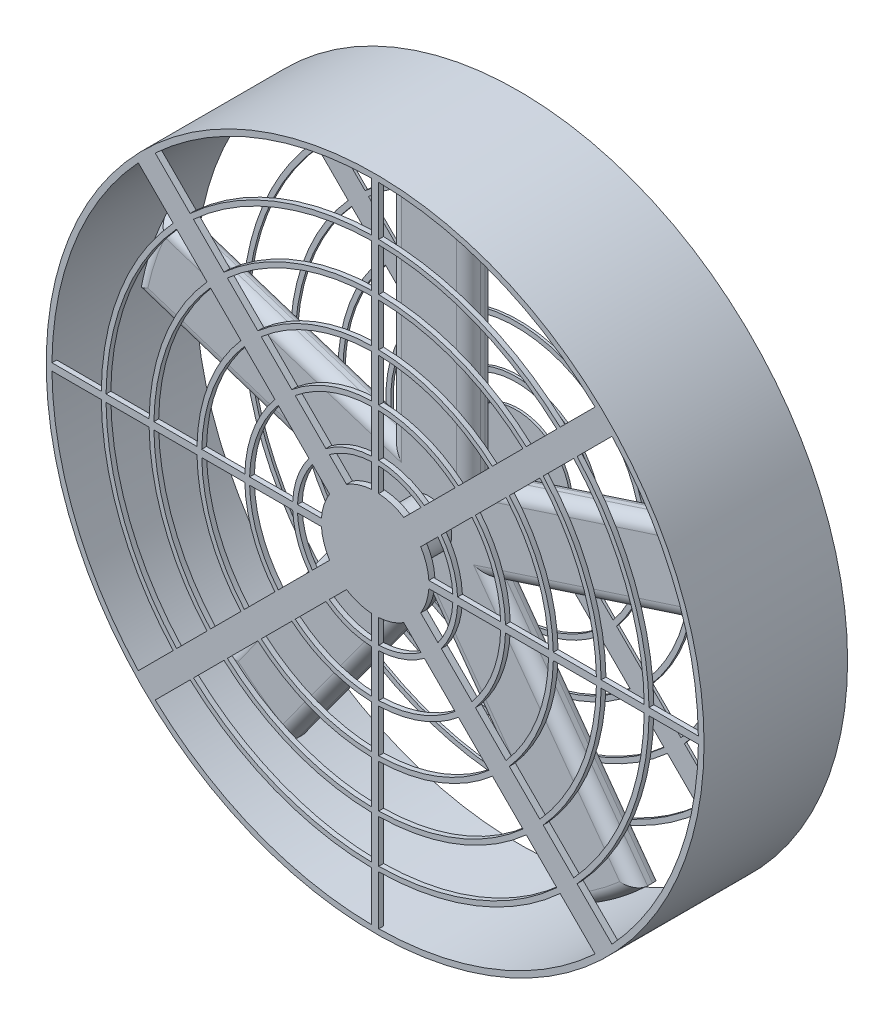
from build123d import *

# Parameters (mm, degrees)
CROQUIS1_R              = 275
CROQUIS1_R_2            = 270.2375
SALIENTE_EXTRUIR1_DEPTH = 120
SALIENTE_EXTRUIR2_DEPTH = 5
CROQUIS3_R              = 45
SALIENTE_EXTRUIR3_DEPTH = 5
CROQUIS5_R              = 19.05
SALIENTE_EXTRUIR4_DEPTH = 40
SALIENTE_EXTRUIR5_DEPTH = 20
MATRIZC1_COUNT          = 5
REDONDEO1_R             = 10
REDONDEO2_R             = 10
SALIENTE_EXTRUIR6_START = -4
SALIENTE_EXTRUIR6_DEPTH = 4
MATRIZC2_COUNT          = 4
SALIENTE_EXTRUIR7_DEPTH = 4
REDONDEO3_R             = 6
CROQUIS9_R              = 270.23749999999995
SALIENTE_EXTRUIR8_DEPTH = 2
CORTAR_EXTRUIR1_START   = -10
CORTAR_EXTRUIR1_DEPTH   = 10


with BuildPart() as part:
    # Croquis1 → Saliente-Extruir1 (new body)
    with BuildSketch(Plane.XY):
        Circle(CROQUIS1_R)
        Circle(CROQUIS1_R_2, mode=Mode.SUBTRACT)
    extrude(amount=SALIENTE_EXTRUIR1_DEPTH)

    # Croquis2 → Saliente-Extruir2 (add)
    with BuildSketch(Plane.XY.offset(120)):
        with BuildLine():
            Line((3.123e-14, 14.14213562373098), (185.24951091022544, 199.3916465339564))
            ThreePointArc((185.24951091022544, 199.3916465339564), (192.45052610995893, 192.4505261099589), (199.3916465339564, 185.24951091022544))
            Line((199.3916465339564, 185.24951091022544), (14.14213562373095, 0))
            Line((14.14213562373095, 0), (199.3916465339564, -185.24951091022544))
            ThreePointArc((199.3916465339564, -185.24951091022544), (192.45052610995893, -192.4505261099589), (185.24951091022544, -199.3916465339564))
            Line((185.24951091022544, -199.3916465339564), (3.123e-14, -14.14213562373098))
            Line((3.123e-14, -14.14213562373098), (-185.24951091022533, -199.39164653395645))
            ThreePointArc((-185.24951091022533, -199.39164653395645), (-192.45052610995876, -192.45052610995896), (-199.39164653395628, -185.2495109102255))
            Line((-199.39164653395628, -185.2495109102255), (-14.142135623730884, -3.46e-15))
            Line((-14.142135623730884, -3.46e-15), (-199.3916465339564, 185.24951091022538))
            ThreePointArc((-199.3916465339564, 185.24951091022538), (-192.45052610995884, 192.45052610995887), (-185.24951091022544, 199.39164653395633))
            Line((-185.24951091022544, 199.39164653395633), (3.123e-14, 14.14213562373098))
        make_face()
    extrude(amount=-SALIENTE_EXTRUIR2_DEPTH)

    # Croquis3 → Saliente-Extruir3 (add)
    with BuildSketch(Plane(origin=(0, 0, 114.99999999999999), x_dir=(-1, 0, 0), z_dir=(0, 0, -1))):
        Circle(CROQUIS3_R)
    extrude(amount=-SALIENTE_EXTRUIR3_DEPTH)

    # Croquis5 → Saliente-Extruir4 (add)
    with BuildSketch(Plane(origin=(0, 0, 114.99999999999999), x_dir=(-1, 0, 0), z_dir=(0, 0, -1))):
        with Locations(Location((0, 0, 0), (0, 0, 180))):
            Circle(CROQUIS5_R)
    extrude(amount=SALIENTE_EXTRUIR4_DEPTH)

    # Croquis6 → Saliente-Extruir5 (add)
    with BuildSketch(Plane(origin=(0, 0, 74.99999999999999), x_dir=(-1, 0, 0), z_dir=(0, 0, -1))):
        with BuildLine():
            ThreePointArc((-19.05, 2.33e-15), (-13.47038418160386, 13.4703841816036), (-3.7107e-13, 19.05))
            Line((0, 19.05), (0, 250.77270509750062))
            ThreePointArc((6.35225e-12, 250.77270509750062), (-16.535989256954046, 250.22691837852284), (-33.000000000000014, 248.59193394379898))
            Line((-33, 248.59193394379895), (-33, -1.587966e-11))
            Line((-33, -1.587966e-11), (-19.05, -1.585473e-11))
        make_face()
        with BuildLine():
            Line((0, 19.05), (0, 0))
            Line((0, 0), (19.05, 0))
            ThreePointArc((19.05, 0), (13.4703841816036, 13.470384181603864), (-3.7107e-13, 19.05))
        make_face()
        with BuildLine():
            Line((-19.05, -1.585473e-11), (-4.163e-14, -1.582068e-11))
            Line((0, 0), (0, 19.05))
            ThreePointArc((-3.7107e-13, 19.05), (-13.47038418160386, 13.4703841816036), (-19.05, 2.33e-15))
        make_face()
        with BuildLine():
            Line((0, 250.77270509750062), (0, 19.05))
            ThreePointArc((-3.7107e-13, 19.05), (13.4703841816036, 13.470384181603864), (19.05, 0))
            Line((19.05, 0), (33, 0))
            Line((33, 0), (33, 248.59193394379895))
            ThreePointArc((33.00000000000001, 248.59193394379898), (16.53598925696038, 250.2269183785224), (6.35225e-12, 250.77270509750062))
        make_face()
    saliente_extruir5 = extrude(amount=SALIENTE_EXTRUIR5_DEPTH)

    # MatrizC1: Saliente-Extruir5 ×5 about axis
    matrizc1_axis = Axis((0, 0, 0), (0, 0, 1))
    for i in range(1, MATRIZC1_COUNT):
        add(saliente_extruir5.rotate(matrizc1_axis, i * 360 / MATRIZC1_COUNT))

    # Redondeo1
    redondeo1_edges = [part.edges().sort_by_distance(p)[0] for p in [
        (-1.599e-14, 250.77270509750065, 74.99999999999999),
        (33, 147.00626865967382, 74.99999999999999),
        (-33, 147.00626865967385, 74.99999999999999),
    ]]
    fillet(redondeo1_edges, radius=REDONDEO1_R)

    # Redondeo2
    redondeo2_edges = [part.edges().sort_by_distance(p)[0] for p in [
        (-124.61370893064556, 75.18770185206401, 74.99999999999999),
        (-238.49901529194085, 77.4930276005047, 74.99999999999999),
        (-150.00883055939212, 14.042570257748391, 74.99999999999999),
        (-113.10567752707475, -99.53365629967374, 74.99999999999999),
        (-147.40049773380042, -202.87938014925504, 74.99999999999999),
        (-59.71055589832824, -138.327482950977, 74.99999999999999),
        (59.71055589832821, -138.327482950977, 74.99999999999999),
        (147.40049773380036, -202.87938014925504, 74.99999999999999),
        (113.10567752707473, -99.53365629967377, 74.99999999999999),
        (150.0088305593921, 14.042570257748345, 74.99999999999999),
        (238.49901529194088, 77.49302760050467, 74.99999999999999),
        (124.61370893064557, 75.18770185206395, 74.99999999999999),
    ]]
    fillet(redondeo2_edges, radius=REDONDEO2_R)

    # Croquis7 → Saliente-Extruir6 (add)
    with BuildSketch(Plane.XY.offset(120).offset(SALIENTE_EXTRUIR6_START)):
        with BuildLine():
            Line((-2.999999999999999, 44.899888641286736), (-2.9999999999999982, 270.22084746786254))
            ThreePointArc((-2.9999999999999982, 270.22084746786254), (1.41e-14, 270.23749999999967), (2.999999999999999, 270.2208474678626))
            Line((2.999999999999999, 270.2208474678626), (2.999999999999999, 44.89988864128678))
            ThreePointArc((2.999999999999999, 44.89988864128678), (-2.59e-15, 44.999999999999446), (-2.999999999999999, 44.899888641286736))
        make_face()
    saliente_extruir6 = extrude(amount=SALIENTE_EXTRUIR6_DEPTH)

    # MatrizC2: Saliente-Extruir6 ×4 about axis
    matrizc2_axis = Axis((0, 0, 0), (0, 0, 1))
    for i in range(1, MATRIZC2_COUNT):
        add(saliente_extruir6.rotate(matrizc2_axis, i * 360 / MATRIZC2_COUNT))

    # Croquis8 → Saliente-Extruir7 (add)
    with BuildSketch(Plane.XY.offset(120)):
        with BuildLine():
            ThreePointArc((-38.34368749959801, 52.48582312332704), (-21.588053762742746, 61.31032486243185), (-2.9999999999996327, 64.93073232299173))
            Line((-3.0000000000000315, 64.93073232299173), (-3.00000000000003, 68.93475175845617))
            ThreePointArc((-3.0000000000019074, 68.93475175845626), (-23.122799412180825, 65.01027724401773), (-41.204184647341165, 55.34632027106965))
            Line((-41.204184647340085, 55.34632027107108), (-38.34368749959717, 52.48582312332817))
        make_face()
        with BuildLine():
            ThreePointArc((-2.9999999999996327, 64.93073232299173), (1.1944e-13, 65), (2.9999999999998566, 64.93073232299172))
            Line((2.999999999999999, 64.93073232299172), (2.999999999999999, 68.93475175845627))
            ThreePointArc((3.0000000000008598, 68.9347517584563), (-5.1669e-13, 69), (-3.0000000000019074, 68.93475175845626))
            Line((-3.00000000000003, 68.93475175845617), (-3.0000000000000315, 64.93073232299173))
        make_face()
        with BuildLine():
            ThreePointArc((2.9999999999998566, 64.93073232299172), (21.588053762742867, 61.310324862431806), (38.34368749959804, 52.485823123327016))
            Line((38.343687499597166, 52.48582312332812), (41.2041846473401, 55.34632027107105))
            ThreePointArc((41.20418464734122, 55.3463202710696), (23.12279941218037, 65.0102772440179), (3.0000000000008598, 68.9347517584563))
            Line((2.999999999999999, 68.93475175845627), (2.999999999999999, 64.93073232299172))
        make_face()
        with BuildLine():
            ThreePointArc((-52.485823123326995, 38.34368749959807), (-45.96194077712556, 45.96194077712561), (-38.34368749959801, 52.48582312332704))
            Line((-38.34368749959717, 52.48582312332817), (-41.204184647340085, 55.34632027107108))
            ThreePointArc((-41.204184647341165, 55.34632027106965), (-48.790367901871726, 48.790367901871825), (-55.34632027106959, 41.20418464734125))
            Line((-55.34632027107105, 41.20418464734013), (-52.485823123328146, 38.34368749959722))
        make_face()
        with BuildLine():
            ThreePointArc((38.34368749959804, 52.485823123327016), (45.96194077712559, 45.961940777125584), (52.485823123327016, 38.34368749959804))
            Line((52.48582312332815, 38.3436874995972), (55.346320271071065, 41.204184647340114))
            ThreePointArc((55.346320271069615, 41.204184647341194), (48.79036790187179, 48.79036790187177), (41.20418464734122, 55.3463202710696))
            Line((41.2041846473401, 55.34632027107105), (38.343687499597166, 52.48582312332812))
        make_face()
        with BuildLine():
            ThreePointArc((52.485823123327016, 38.34368749959804), (61.31032486243132, 21.58805376274424), (64.93073232299157, 3.000000000002762))
            Line((64.9307323229915, 3.0000000000007114), (68.93475175845626, 3.0000000000007523))
            ThreePointArc((68.93475175845629, 3.0000000000013882), (65.01027724401781, 23.122799412180605), (55.346320271069615, 41.204184647341194))
            Line((55.346320271071065, 41.204184647340114), (52.48582312332815, 38.3436874995972))
        make_face()
        with BuildLine():
            ThreePointArc((64.93073232299157, 3.000000000002762), (64.98268077339705, 1.500399780982948), (65, 0))
            ThreePointArc((65, -1.592e-14), (64.98268077339706, -1.5003997809823382), (64.93073232299164, -3.000000000001469))
            Line((64.93073232299153, -2.999999999999319), (68.9347517584563, -2.9999999999992775))
            ThreePointArc((68.93475175845634, -3.000000000000107), (68.98368601101816, -1.500354735806307), (69, -1.69e-14))
            ThreePointArc((69, 0), (68.98368601101815, 1.500354735806909), (68.93475175845629, 3.0000000000013882))
            Line((68.93475175845626, 3.0000000000007523), (64.9307323229915, 3.0000000000007114))
        make_face()
        with BuildLine():
            Line((68.9347517584563, -2.9999999999992775), (64.93073232299153, -2.999999999999319))
            ThreePointArc((64.93073232299164, -3.000000000001469), (61.31032486243152, -21.588053762743677), (52.48582312332699, -38.343687499598076))
            Line((52.48582312332812, -38.343687499597166), (55.34632027107105, -41.2041846473401))
            ThreePointArc((55.34632027106958, -41.20418464734125), (65.01027724401803, -23.122799412180008), (68.93475175845634, -3.000000000000107))
        make_face()
        with BuildLine():
            Line((55.34632027107105, -41.2041846473401), (52.48582312332812, -38.343687499597166))
            ThreePointArc((52.48582312332699, -38.343687499598076), (45.96194077712558, -45.9619407771256), (38.343687499598055, -52.485823123327))
            Line((38.343687499597216, -52.48582312332816), (41.20418464734013, -55.34632027107108))
            ThreePointArc((41.20418464734123, -55.346320271069594), (48.79036790187177, -48.79036790187179), (55.34632027106958, -41.20418464734125))
        make_face()
        with BuildLine():
            Line((41.20418464734013, -55.34632027107108), (38.343687499597216, -52.48582312332816))
            ThreePointArc((38.343687499598055, -52.485823123327), (21.58805376274289, -61.3103248624318), (2.999999999999884, -64.93073232299172))
            Line((3.0000000000000315, -64.93073232299173), (3.00000000000003, -68.93475175845629))
            ThreePointArc((3.0000000000008122, -68.93475175845631), (23.122799412180324, -65.01027724401791), (41.20418464734123, -55.346320271069594))
        make_face()
        with BuildLine():
            Line((3.00000000000003, -68.93475175845629), (3.0000000000000315, -64.93073232299173))
            ThreePointArc((2.999999999999884, -64.93073232299172), (1.0352e-13, -65), (-2.99999999999962, -64.93073232299173))
            Line((-2.999999999999999, -64.93073232299174), (-2.999999999999999, -68.93475175845619))
            ThreePointArc((-3.0000000000018785, -68.93475175845626), (-5.0295e-13, -69), (3.0000000000008122, -68.93475175845631))
        make_face()
        with BuildLine():
            Line((-2.999999999999999, -68.93475175845619), (-2.999999999999999, -64.93073232299174))
            ThreePointArc((-2.99999999999962, -64.93073232299173), (-21.58805376274275, -61.31032486243185), (-38.343687499598026, -52.48582312332702))
            Line((-38.343687499597166, -52.4858231233282), (-41.2041846473401, -55.346320271071136))
            ThreePointArc((-41.20418464734125, -55.34632027106958), (-23.122799412180868, -65.01027724401771), (-3.0000000000018785, -68.93475175845626))
        make_face()
        with BuildLine():
            Line((-41.2041846473401, -55.346320271071136), (-38.343687499597166, -52.4858231233282))
            ThreePointArc((-38.343687499598026, -52.48582312332702), (-45.961940777125555, -45.96194077712562), (-52.48582312332699, -38.34368749959808))
            Line((-52.4858231233281, -38.343687499597245), (-55.346320271071015, -41.204184647340156))
            ThreePointArc((-55.346320271069594, -41.204184647341236), (-48.79036790187179, -48.790367901871775), (-41.20418464734125, -55.34632027106958))
        make_face()
        with BuildLine():
            Line((-55.346320271071015, -41.204184647340156), (-52.4858231233281, -38.343687499597245))
            ThreePointArc((-52.48582312332699, -38.34368749959808), (-61.31032486243176, -21.588053762743), (-64.9307323229917, -3.000000000000061))
            Line((-64.93073232299173, -3.000000000000258), (-68.9347517584564, -3.000000000000271))
            ThreePointArc((-68.93475175845637, -2.999999999999347), (-65.01027724401814, -23.122799412179667), (-55.346320271069594, -41.204184647341236))
        make_face()
        with BuildLine():
            ThreePointArc((-64.9307323229917, -3.000000000000061), (-65, -2.2297e-13), (-64.93073232299173, 2.999999999999616))
            Line((-64.93073232299173, 2.9999999999997726), (-68.93475175845643, 2.999999999999759))
            ThreePointArc((-68.9347517584564, 2.9999999999988742), (-69, -2.3669e-13), (-68.93475175845637, -2.999999999999347))
            Line((-68.9347517584564, -3.000000000000271), (-64.93073232299173, -3.000000000000258))
        make_face()
        with BuildLine():
            ThreePointArc((-64.93073232299173, 2.999999999999616), (-61.31032486243184, 21.58805376274277), (-52.485823123326995, 38.34368749959807))
            Line((-52.485823123328146, 38.34368749959722), (-55.34632027107105, 41.20418464734013))
            ThreePointArc((-55.34632027106959, 41.20418464734125), (-65.01027724401823, 23.12279941217945), (-68.9347517584564, 2.9999999999988742))
            Line((-68.93475175845643, 2.999999999999759), (-64.93073232299173, 2.9999999999997726))
        make_face()
        with BuildLine():
            ThreePointArc((-80.97979530733559, 66.83765968360973), (-74.24621202458748, 74.24621202458749), (-66.83765968360969, 80.97979530733562))
            Line((-66.8376596836074, 80.97979530733838), (-69.67852502093112, 83.8206606446621))
            ThreePointArc((-69.67852502093318, 83.82066064465963), (-77.07463914933368, 77.07463914933369), (-83.8206606446596, 69.67852502093322))
            Line((-83.82066064466207, 69.67852502093112), (-80.97979530733836, 66.83765968360743))
        make_face()
        with BuildLine():
            ThreePointArc((-104.95713410721537, 3.000000000001689), (-98.29520399540338, 36.91954592762533), (-80.97979530733559, 66.83765968360973))
            Line((-80.97979530733836, 66.83765968360743), (-83.82066064466207, 69.67852502093112))
            ThreePointArc((-83.8206606446596, 69.67852502093322), (-101.99253721137411, 38.45155852740523), (-108.95870777500996, 2.999999999998256))
            Line((-108.95870777500998, 2.999999999999619), (-104.95713410721531, 2.999999999999633))
        make_face()
        with BuildLine():
            ThreePointArc((-66.83765968360969, 80.97979530733562), (-36.919545927623524, 98.29520399540405), (-2.9999999999978706, 104.95713410721547))
            Line((-3.00000000000002, 104.95713410721552), (-3.0000000000000187, 108.95870777500994))
            ThreePointArc((-2.9999999999995186, 108.95870777500991), (-38.4515585274058, 101.9925372113739), (-69.67852502093318, 83.82066064465963))
            Line((-69.67852502093112, 83.8206606446621), (-66.8376596836074, 80.97979530733838))
        make_face()
        with BuildLine():
            ThreePointArc((3.0000000000020552, 104.95713410721535), (36.91954592762547, 98.29520399540333), (66.83765968360969, 80.97979530733562))
            Line((66.83765968360738, 80.97979530733834), (69.67852502093115, 83.8206606446621))
            ThreePointArc((69.67852502093324, 83.8206606446596), (38.45155852740584, 101.99253721137389), (2.9999999999995315, 108.95870777500991))
            Line((2.999999999999999, 108.95870777500993), (2.999999999999999, 104.9571341072153))
        make_face()
        with BuildLine():
            ThreePointArc((-2.9999999999978706, 104.95713410721547), (2.10475e-12, 105), (3.0000000000020552, 104.95713410721535))
            Line((2.999999999999999, 104.9571341072153), (2.999999999999999, 108.95870777500993))
            ThreePointArc((2.9999999999995315, 108.95870777500991), (6.67e-15, 109.00000000000001), (-2.9999999999995186, 108.95870777500991))
            Line((-3.0000000000000187, 108.95870777500994), (-3.00000000000002, 104.95713410721552))
        make_face()
        with BuildLine():
            ThreePointArc((66.83765968360969, 80.97979530733562), (74.24621202458748, 74.24621202458749), (80.9797953073356, 66.83765968360969))
            Line((80.97979530733838, 66.83765968360743), (83.8206606446621, 69.67852502093115))
            ThreePointArc((83.82066064465961, 69.6785250209332), (77.0746391493337, 77.07463914933368), (69.67852502093324, 83.8206606446596))
            Line((69.67852502093115, 83.8206606446621), (66.83765968360738, 80.97979530733834))
        make_face()
        with BuildLine():
            ThreePointArc((80.9797953073356, 66.83765968360969), (98.29520399540364, 36.91954592762462), (104.9571341072154, 3.0000000000002185))
            Line((104.95713410721544, 3.000000000001119), (108.95870777500994, 3.00000000000116))
            ThreePointArc((108.9587077750099, 3.0000000000001883), (101.99253721137379, 38.45155852740612), (83.82066064465961, 69.6785250209332))
            Line((83.8206606446621, 69.67852502093115), (80.97979530733838, 66.83765968360743))
        make_face()
        with BuildLine():
            Line((108.95870777500994, 3.00000000000116), (104.95713410721544, 3.000000000001119))
            ThreePointArc((104.9571341072154, 3.0000000000002185), (104.98928297987756, 1.5001531159156332), (105, 0))
            ThreePointArc((105, -2.572e-14), (104.98928297987757, -1.5001531159146626), (104.95713410721545, -2.9999999999983458))
            Line((104.95713410721547, -2.9999999999989), (108.95870777500997, -2.999999999998858))
            ThreePointArc((108.95870777500996, -2.999999999998173), (108.98967645487367, -1.5001420805904724), (109.00000000000001, -2.67e-14))
            ThreePointArc((109.00000000000001, 0), (108.98967645487366, 1.5001420805915155), (108.9587077750099, 3.0000000000001883))
        make_face()
        with BuildLine():
            Line((108.95870777500997, -2.999999999998858), (104.95713410721547, -2.9999999999989))
            ThreePointArc((104.95713410721545, -2.9999999999983458), (98.295203995404, -36.91954592762369), (80.97979530733569, -66.8376596836096))
            Line((80.97979530733834, -66.83765968360738), (83.8206606446621, -69.67852502093115))
            ThreePointArc((83.82066064465958, -69.67852502093324), (101.99253721137414, -38.451558527405155), (108.95870777500996, -2.999999999998173))
        make_face()
        with BuildLine():
            Line((83.8206606446621, -69.67852502093115), (80.97979530733834, -66.83765968360738))
            ThreePointArc((80.97979530733569, -66.8376596836096), (74.24621202458754, -74.24621202458744), (66.83765968360963, -80.97979530733566))
            Line((66.8376596836074, -80.97979530733835), (69.67852502093115, -83.8206606446621))
            ThreePointArc((69.6785250209332, -83.82066064465961), (77.07463914933368, -77.0746391493337), (83.82066064465958, -69.67852502093324))
        make_face()
        with BuildLine():
            Line((69.67852502093115, -83.8206606446621), (66.8376596836074, -80.97979530733835))
            ThreePointArc((66.83765968360963, -80.97979530733566), (36.919545927625386, -98.29520399540336), (3.0000000000020295, -104.95713410721535))
            Line((3.00000000000002, -104.9571341072153), (3.0000000000000187, -108.95870777500994))
            ThreePointArc((2.9999999999995777, -108.95870777500991), (38.45155852740584, -101.99253721137389), (69.6785250209332, -83.82066064465961))
        make_face()
        with BuildLine():
            Line((3.0000000000000187, -108.95870777500994), (3.00000000000002, -104.9571341072153))
            ThreePointArc((3.0000000000020295, -104.95713410721535), (2.12566e-12, -105), (-2.99999999999778, -104.95713410721547))
            Line((-2.999999999999999, -104.95713410721554), (-2.999999999999999, -108.95870777500993))
            ThreePointArc((-2.999999999999521, -108.95870777500991), (-2.002e-14, -109.00000000000001), (2.9999999999995777, -108.95870777500991))
        make_face()
        with BuildLine():
            Line((-2.999999999999999, -108.95870777500993), (-2.999999999999999, -104.95713410721554))
            ThreePointArc((-2.99999999999778, -104.95713410721547), (-36.91954592762333, -98.29520399540412), (-66.83765968360952, -80.97979530733576))
            Line((-66.83765968360733, -80.97979530733839), (-69.67852502093109, -83.82066064466215))
            ThreePointArc((-69.67852502093324, -83.82066064465958), (-38.45155852740587, -101.99253721137387), (-2.999999999999521, -108.95870777500991))
        make_face()
        with BuildLine():
            Line((-69.67852502093109, -83.82066064466215), (-66.83765968360733, -80.97979530733839))
            ThreePointArc((-66.83765968360952, -80.97979530733576), (-74.24621202458736, -74.2462120245876), (-80.97979530733558, -66.83765968360974))
            Line((-80.9797953073383, -66.83765968360746), (-83.82066064466204, -69.6785250209312))
            ThreePointArc((-83.82066064465958, -69.67852502093325), (-77.0746391493337, -77.07463914933368), (-69.67852502093324, -83.82066064465958))
        make_face()
        with BuildLine():
            Line((-83.82066064466204, -69.6785250209312), (-80.9797953073383, -66.83765968360746))
            ThreePointArc((-80.97979530733558, -66.83765968360974), (-98.29520399540326, -36.919545927625656), (-104.95713410721534, -3.000000000002362))
            Line((-104.95713410721527, -3.0000000000003864), (-108.95870777500997, -3.000000000000399))
            ThreePointArc((-108.95870777500994, -2.999999999998907), (-101.99253721137399, -38.45155852740557), (-83.82066064465958, -69.67852502093325))
        make_face()
        with BuildLine():
            ThreePointArc((-104.95713410721534, -3.000000000002362), (-105, -3.6018e-13), (-104.95713410721537, 3.000000000001689))
            Line((-104.95713410721531, 2.999999999999633), (-108.95870777500998, 2.999999999999619))
            ThreePointArc((-108.95870777500996, 2.999999999998256), (-109.00000000000001, -3.2549e-13), (-108.95870777500994, -2.999999999998907))
            Line((-108.95870777500997, -3.000000000000399), (-104.95713410721527, -3.0000000000003864))
        make_face()
        with BuildLine():
            ThreePointArc((-144.96896219536094, -3.000000000000942), (-145, -3.686e-13), (-144.96896219536097, 3.0000000000001403))
            Line((-144.96896219536094, 2.9999999999994933), (-148.96979559628878, 2.9999999999994795))
            ThreePointArc((-148.9697955962887, 2.999999999995728), (-149.00000000000003, -3.7877e-13), (-148.96979559628866, -2.999999999996551))
            Line((-148.96979559628875, -3.000000000000527), (-144.96896219536094, -3.0000000000005143))
        make_face()
        with BuildLine():
            ThreePointArc((-144.96896219536097, 3.0000000000001403), (-135.2641625281457, 52.23606355344351), (-109.35743053926011, 95.21529491552764))
            Line((-109.35743053925931, 95.21529491552833), (-112.19242625057662, 98.05029062684565))
            ThreePointArc((-112.19242625057733, 98.05029062684504), (-138.96066338018124, 53.767406790173204), (-148.9697955962887, 2.999999999995728))
            Line((-148.96979559628878, 2.9999999999994795), (-144.96896219536094, 2.9999999999994933))
        make_face()
        with BuildLine():
            Line((-112.19242625057655, -98.05029062684571), (-109.35743053925921, -95.21529491552835))
            ThreePointArc((-109.35743053926008, -95.21529491552765), (-135.2641625281455, -52.236063553443955), (-144.96896219536094, -3.000000000000942))
            Line((-144.96896219536094, -3.0000000000005143), (-148.96979559628875, -3.000000000000527))
            ThreePointArc((-148.96979559628866, -2.999999999996551), (-138.9606633801811, -53.7674067901736), (-112.19242625057734, -98.05029062684501))
        make_face()
        with BuildLine():
            ThreePointArc((-109.35743053926011, 95.21529491552764), (-102.53048327204938, 102.5304832720494), (-95.21529491552761, 109.35743053926012))
            Line((-95.21529491552833, 109.35743053925927), (-98.05029062684568, 112.19242625057663))
            ThreePointArc((-98.05029062684501, 112.19242625057734), (-105.3589103967956, 105.35891039679561), (-112.19242625057733, 98.05029062684504))
            Line((-112.19242625057662, 98.05029062684565), (-109.35743053925931, 95.21529491552833))
        make_face()
        with BuildLine():
            ThreePointArc((-95.21529491552761, 109.35743053926012), (-52.236063553445526, 135.2641625281449), (-3.0000000000043947, 144.9689621953609))
            Line((-3.000000000000008, 144.9689621953608), (-3.000000000000007, 148.96979559628863))
            ThreePointArc((-2.9999999999994054, 148.9697955962886), (-53.76740679017491, 138.9606633801806), (-98.05029062684501, 112.19242625057734))
            Line((-98.05029062684568, 112.19242625057663), (-95.21529491552833, 109.35743053925927))
        make_face()
        with BuildLine():
            ThreePointArc((-3.0000000000043947, 144.9689621953609), (-2.69562e-12, 145), (2.999999999999037, 144.968962195361))
            Line((2.999999999999999, 144.96896219536103), (2.999999999999999, 148.9697955962885))
            ThreePointArc((3.0000000000024007, 148.96979559628855), (1.49793e-12, 149.00000000000003), (-2.9999999999994054, 148.9697955962886))
            Line((-3.000000000000007, 148.96979559628863), (-3.000000000000008, 144.9689621953608))
        make_face()
        with BuildLine():
            ThreePointArc((2.999999999999037, 144.968962195361), (52.236063553443024, 135.26416252814587), (95.21529491552764, 109.3574305392601))
            Line((95.21529491552832, 109.35743053925927), (98.05029062684565, 112.1924262505766))
            ThreePointArc((98.05029062684507, 112.1924262505773), (53.76740679017634, 138.96066338018002), (3.0000000000024007, 148.96979559628855))
            Line((2.999999999999999, 148.9697955962885), (2.999999999999999, 144.96896219536103))
        make_face()
        with BuildLine():
            ThreePointArc((95.21529491552764, 109.3574305392601), (102.5304832720494, 102.53048327204938), (109.3574305392601, 95.21529491552764))
            Line((109.3574305392593, 95.21529491552835), (112.19242625057664, 98.0502906268457))
            ThreePointArc((112.19242625057731, 98.05029062684505), (105.35891039679561, 105.3589103967956), (98.05029062684507, 112.1924262505773))
            Line((98.05029062684565, 112.1924262505766), (95.21529491552832, 109.35743053925927))
        make_face()
        with BuildLine():
            ThreePointArc((109.3574305392601, 95.21529491552764), (135.2641625281446, 52.23606355344634), (144.96896219536086, 3.000000000006123))
            Line((144.96896219536077, 3.0000000000015263), (148.96979559628852, 3.000000000001567))
            ThreePointArc((148.96979559628855, 3.00000000000276), (138.96066338017997, 53.767406790176494), (112.19242625057731, 98.05029062684505))
            Line((112.19242625057664, 98.0502906268457), (109.3574305392593, 95.21529491552835))
        make_face()
        with BuildLine():
            Line((148.96979559628852, 3.000000000001567), (144.96896219536077, 3.0000000000015263))
            ThreePointArc((144.96896219536086, 3.000000000006123), (144.99224034121158, 1.5000802766313506), (145, 0))
            ThreePointArc((145, -3.551e-14), (144.99224034121158, -1.5000802766301884), (144.96896219536092, -3.0000000000036344))
            Line((144.9689621953608, -2.9999999999984808), (148.96979559628858, -2.9999999999984386))
            ThreePointArc((148.9697955962886, -3.0000000000002447), (148.99244870772313, -1.5000760235739097), (149.00000000000003, -3.649e-14))
            ThreePointArc((149.00000000000003, 0), (148.99244870772313, 1.5000760235751494), (148.96979559628855, 3.00000000000276))
        make_face()
        with BuildLine():
            Line((148.96979559628858, -2.9999999999984386), (144.9689621953608, -2.9999999999984808))
            ThreePointArc((144.96896219536092, -3.0000000000036344), (135.26416252814502, -52.236063553445206), (109.35743053926004, -95.2152949155277))
            Line((109.35743053925925, -95.2152949155283), (112.1924262505766, -98.05029062684565))
            ThreePointArc((112.19242625057723, -98.05029062684515), (138.9606633801804, -53.76740679017538), (148.9697955962886, -3.0000000000002447))
        make_face()
        with BuildLine():
            Line((112.1924262505766, -98.05029062684565), (109.35743053925925, -95.2152949155283))
            ThreePointArc((109.35743053926004, -95.2152949155277), (102.53048327204937, -102.53048327204941), (95.21529491552765, -109.3574305392601))
            Line((95.21529491552837, -109.35743053925933), (98.0502906268457, -112.19242625057663))
            ThreePointArc((98.0502906268451, -112.19242625057726), (105.35891039679558, -105.35891039679562), (112.19242625057723, -98.05029062684515))
        make_face()
        with BuildLine():
            Line((98.0502906268457, -112.19242625057663), (95.21529491552837, -109.35743053925933))
            ThreePointArc((95.21529491552765, -109.3574305392601), (52.23606355344299, -135.26416252814587), (2.999999999998937, -144.968962195361))
            Line((3.000000000000008, -144.96896219536103), (3.000000000000007, -148.96979559628852))
            ThreePointArc((3.0000000000022977, -148.96979559628855), (53.7674067901763, -138.96066338018005), (98.0502906268451, -112.19242625057726))
        make_face()
        with BuildLine():
            Line((3.000000000000007, -148.96979559628852), (3.000000000000008, -144.96896219536103))
            ThreePointArc((2.999999999998937, -144.968962195361), (-2.85993e-12, -145), (-3.000000000004527, -144.9689621953609))
            Line((-2.999999999999999, -144.9689621953608), (-2.999999999999999, -148.96979559628863))
            ThreePointArc((-2.9999999999994422, -148.9697955962886), (1.42835e-12, -149.00000000000003), (3.0000000000022977, -148.96979559628855))
        make_face()
        with BuildLine():
            Line((-2.999999999999999, -148.96979559628863), (-2.999999999999999, -144.9689621953608))
            ThreePointArc((-3.000000000004527, -144.9689621953609), (-52.23606355344556, -135.26416252814488), (-95.2152949155276, -109.35743053926014))
            Line((-95.21529491552826, -109.35743053925934), (-98.0502906268456, -112.19242625057667))
            ThreePointArc((-98.050290626845, -112.19242625057736), (-53.767406790174874, -138.9606633801806), (-2.9999999999994422, -148.9697955962886))
        make_face()
        with BuildLine():
            Line((-98.0502906268456, -112.19242625057667), (-95.21529491552826, -109.35743053925934))
            ThreePointArc((-95.2152949155276, -109.35743053926014), (-102.53048327204937, -102.53048327204941), (-109.35743053926008, -95.21529491552765))
            Line((-109.35743053925921, -95.21529491552835), (-112.19242625057655, -98.05029062684571))
            ThreePointArc((-112.19242625057734, -98.05029062684501), (-105.35891039679562, -105.3589103967956), (-98.050290626845, -112.19242625057736))
        make_face()
        with BuildLine():
            Line((-126.38491744170014, -140.52705306543123), (-123.55243696426604, -137.69457258799713))
            ThreePointArc((-123.55243696426841, -137.6945725879945), (-130.81475451951127, -130.81475451951133), (-137.6945725879944, -123.55243696426848))
            Line((-137.69457258799696, -123.55243696426612), (-140.5270530654311, -126.38491744170025))
            ThreePointArc((-140.52705306543328, -126.3849174416983), (-133.64318164425745, -133.6431816442575), (-126.38491744169825, -140.52705306543334))
        make_face()
        with BuildLine():
            Line((-140.5270530654311, -126.38491744170025), (-137.69457258799696, -123.55243696426612))
            ThreePointArc((-137.6945725879944, -123.55243696426848), (-172.22730484773038, -67.54817143999493), (-184.9756740763498, -3.000000000001872))
            Line((-184.97567407634978, -3.000000000000642), (-188.9761889762836, -3.000000000000655))
            ThreePointArc((-188.97618897628354, -2.999999999996621), (-175.92343815428472, -69.07925816028686), (-140.52705306543328, -126.3849174416983))
        make_face()
        with BuildLine():
            Line((-2.999999999999999, -188.97618897628342), (-2.999999999999999, -184.97567407634995))
            ThreePointArc((-2.999999999997082, -184.9756740763499), (-67.54817143999269, -172.22730484773126), (-123.55243696426841, -137.6945725879945))
            Line((-123.55243696426604, -137.69457258799713), (-126.38491744170014, -140.52705306543123))
            ThreePointArc((-126.38491744169825, -140.52705306543334), (-69.07925816028957, -175.92343815428367), (-3.000000000002469, -188.97618897628342))
        make_face()
        with BuildLine():
            Line((2.999999999999995, -188.97618897628345), (2.9999999999999964, -184.9756740763498))
            ThreePointArc((3.0000000000007923, -184.97567407634983), (1.93777e-12, -185), (-2.999999999997082, -184.9756740763499))
            Line((-2.999999999999999, -184.97567407634995), (-2.999999999999999, -188.97618897628342))
            ThreePointArc((-3.000000000002469, -188.97618897628342), (-1.04191e-12, -189), (3.000000000000218, -188.97618897628345))
        make_face()
        with BuildLine():
            Line((126.38491744170022, -140.52705306543118), (123.55243696426615, -137.6945725879971))
            ThreePointArc((123.55243696426855, -137.69457258799437), (67.54817143999446, -172.22730484773055), (3.0000000000007923, -184.97567407634983))
            Line((2.9999999999999964, -184.9756740763498), (2.999999999999995, -188.97618897628345))
            ThreePointArc((3.000000000000218, -188.97618897628345), (69.07925816028856, -175.92343815428404), (126.3849174416983, -140.52705306543328))
        make_face()
        with BuildLine():
            Line((140.52705306543115, -126.3849174417002), (137.69457258799707, -123.55243696426612))
            ThreePointArc((137.69457258799443, -123.55243696426847), (130.81475451951138, -130.8147545195112), (123.55243696426855, -137.69457258799437))
            Line((123.55243696426615, -137.6945725879971), (126.38491744170022, -140.52705306543118))
            ThreePointArc((126.3849174416983, -140.52705306543328), (133.64318164425757, -133.6431816442574), (140.52705306543334, -126.38491744169825))
        make_face()
        with BuildLine():
            Line((188.9761889762836, -2.9999999999980194), (184.97567407634983, -2.9999999999980616))
            ThreePointArc((184.97567407634986, -2.9999999999989), (172.22730484773095, -67.54817143999345), (137.69457258799443, -123.55243696426847))
            Line((137.69457258799707, -123.55243696426612), (140.52705306543115, -126.3849174417002))
            ThreePointArc((140.52705306543334, -126.38491744169825), (175.92343815428512, -69.07925816028583), (188.97618897628354, -2.999999999994592))
        make_face()
        with BuildLine():
            Line((188.97618897628357, 3.0000000000019744), (184.9756740763498, 3.000000000001934))
            ThreePointArc((184.9756740763498, 3.0000000000019997), (184.9939184191263, 1.5000493117372369), (185, 0))
            ThreePointArc((185, -4.531e-14), (184.99391841912632, -1.5000493117357099), (184.97567407634986, -2.9999999999989))
            Line((184.97567407634983, -2.9999999999980616), (188.9761889762836, -2.9999999999980194))
            ThreePointArc((188.97618897628354, -2.999999999994592), (188.99404715032375, -1.5000472463241163), (189, -4.629e-14))
            ThreePointArc((189, 0), (188.99404715032372, 1.5000472463256305), (188.9761889762835, 2.9999999999976668))
        make_face()
        with BuildLine():
            ThreePointArc((137.6945725879945, 123.55243696426841), (172.22730484773038, 67.54817143999493), (184.9756740763498, 3.0000000000019997))
            Line((184.9756740763498, 3.000000000001934), (188.97618897628357, 3.0000000000019744))
            ThreePointArc((188.9761889762835, 2.9999999999976668), (175.92343815428433, 69.07925816028781), (140.52705306543263, 126.38491744169902))
            Line((140.52705306543123, 126.3849174417003), (137.69457258799707, 123.55243696426614))
        make_face()
        with BuildLine():
            ThreePointArc((123.55243696426845, 137.69457258799446), (130.8147545195113, 130.81475451951127), (137.6945725879945, 123.55243696426841))
            Line((137.69457258799707, 123.55243696426614), (140.52705306543123, 126.3849174417003))
            ThreePointArc((140.52705306543263, 126.38491744169902), (133.64318164425714, 133.64318164425782), (126.38491744169826, 140.52705306543334))
            Line((126.38491744170022, 140.52705306543118), (123.5524369642661, 137.69457258799704))
        make_face()
        with BuildLine():
            ThreePointArc((3.0000000000010023, 184.9756740763498), (67.54817143999449, 172.22730484773055), (123.55243696426845, 137.69457258799446))
            Line((123.5524369642661, 137.69457258799704), (126.38491744170022, 140.52705306543118))
            ThreePointArc((126.38491744169826, 140.52705306543334), (69.07925816028857, 175.92343815428404), (3.0000000000002642, 188.97618897628345))
            Line((2.999999999999999, 188.97618897628348), (2.999999999999999, 184.97567407634983))
        make_face()
        with BuildLine():
            ThreePointArc((-2.999999999996995, 184.9756740763499), (1.98308e-12, 185), (3.000000000000961, 184.97567407634983))
            Line((2.999999999999999, 184.97567407634983), (2.999999999999999, 188.97618897628348))
            ThreePointArc((3.0000000000002642, 188.97618897628345), (-1.16349e-12, 189), (-3.0000000000025486, 188.97618897628342))
            Line((-2.999999999999995, 188.97618897628337), (-2.9999999999999964, 184.97567407634992))
        make_face()
        with BuildLine():
            ThreePointArc((-123.55243696426842, 137.69457258799446), (-67.54817143999264, 172.2273048477313), (-2.999999999996995, 184.9756740763499))
            Line((-2.9999999999999964, 184.97567407634992), (-2.999999999999995, 188.97618897628337))
            ThreePointArc((-3.0000000000025486, 188.97618897628342), (-69.07925816028968, 175.92343815428362), (-126.38491744169833, 140.52705306543325))
            Line((-126.38491744170025, 140.52705306543118), (-123.55243696426611, 137.69457258799702))
        make_face()
        with BuildLine():
            ThreePointArc((-137.6945725879945, 123.55243696426841), (-130.81475451951127, 130.8147545195113), (-123.55243696426842, 137.69457258799446))
            Line((-123.55243696426611, 137.69457258799702), (-126.38491744170025, 140.52705306543118))
            ThreePointArc((-126.38491744169833, 140.52705306543325), (-133.64318164425754, 133.64318164425742), (-140.52705306543334, 126.38491744169822))
            Line((-140.52705306543118, 126.3849174417002), (-137.69457258799707, 123.5524369642661))
        make_face()
        with BuildLine():
            ThreePointArc((-184.97567407634983, 3.0000000000008495), (-172.2273048477306, 67.54817143999435), (-137.6945725879945, 123.55243696426841))
            Line((-137.69457258799707, 123.5524369642661), (-140.52705306543118, 126.3849174417002))
            ThreePointArc((-140.52705306543334, 126.38491744169822), (-175.92343815428492, 69.07925816028636), (-188.97618897628354, 2.9999999999955764))
            Line((-188.9761889762836, 2.9999999999993396), (-184.97567407634978, 2.9999999999993534))
        make_face()
        with BuildLine():
            ThreePointArc((-184.9756740763498, -3.000000000001872), (-185, -4.7028e-13), (-184.97567407634983, 3.0000000000008495))
            Line((-184.97567407634978, 2.9999999999993534), (-188.9761889762836, 2.9999999999993396))
            ThreePointArc((-188.97618897628354, 2.9999999999955764), (-189, -4.8045e-13), (-188.97618897628354, -2.999999999996621))
            Line((-188.9761889762836, -3.000000000000655), (-184.97567407634978, -3.000000000000642))
        make_face()
        with BuildLine():
            ThreePointArc((-224.97999911103219, -2.999999999991857), (-225, -5.7197e-13), (-224.9799991110322, 2.999999999990713))
            Line((-224.97999911103233, 2.999999999999214), (-228.98034850178726, 2.9999999999991998))
            ThreePointArc((-228.98034850178732, 3.000000000004591), (-229, -5.8213e-13), (-228.98034850178732, -3.000000000005755))
            Line((-228.98034850178723, -3.000000000000783), (-224.97999911103233, -3.00000000000077))
        make_face()
        with BuildLine():
            ThreePointArc((-224.9799991110322, 2.999999999990713), (-209.1876736306015, 82.85841659733155), (-166.0128810643913, 151.8707454406551))
            Line((-166.01288106438858, 151.87074544065757), (-168.84405690460645, 154.70192128087544))
            ThreePointArc((-168.84405690460332, 154.70192128087834), (-212.88361283648433, 84.38937957874697), (-228.98034850178732, 3.000000000004591))
            Line((-228.98034850178726, 2.9999999999991998), (-224.97999911103233, 2.999999999999214))
        make_face()
        with BuildLine():
            Line((-168.84405690460636, -154.70192128087555), (-166.01288106438844, -151.87074544065763))
            ThreePointArc((-166.01288106439128, -151.87074544065513), (-209.1876736306013, -82.85841659733207), (-224.97999911103219, -2.999999999991857))
            Line((-224.97999911103233, -3.00000000000077), (-228.98034850178723, -3.000000000000783))
            ThreePointArc((-228.98034850178732, -3.000000000005755), (-212.88361283648408, -84.38937957874766), (-168.84405690460312, -154.7019212808785))
        make_face()
        with BuildLine():
            Line((-154.70192128087538, -168.8440569046065), (-151.87074544065757, -166.01288106438867))
            ThreePointArc((-151.87074544065504, -166.0128810643914), (-159.09902576697314, -159.09902576697323), (-166.01288106439128, -151.87074544065513))
            Line((-166.01288106438844, -151.87074544065763), (-168.84405690460636, -154.70192128087555))
            ThreePointArc((-168.84405690460312, -154.7019212808785), (-161.92745289171935, -161.9274528917194), (-154.70192128087845, -168.84405690460324))
        make_face()
        with BuildLine():
            Line((-2.999999999999999, -228.9803485017871), (-2.999999999999999, -224.97999911103204))
            ThreePointArc((-3.000000000002117, -224.97999911103207), (-82.85841659733677, -209.18767363059942), (-151.87074544065504, -166.0128810643914))
            Line((-151.87074544065757, -166.01288106438867), (-154.70192128087538, -168.8440569046065))
            ThreePointArc((-154.70192128087845, -168.84405690460324), (-84.38937957874953, -212.88361283648334), (-3.0000000000101976, -228.98034850178723))
        make_face()
        with BuildLine():
            Line((2.9999999999999836, -228.98034850178723), (2.999999999999985, -224.97999911103207))
            ThreePointArc((3.0000000000002354, -224.9799991110321), (-8.4069e-13, -225), (-3.000000000002117, -224.97999911103207))
            Line((-2.999999999999999, -224.97999911103204), (-2.999999999999999, -228.9803485017871))
            ThreePointArc((-3.0000000000101976, -228.98034850178723), (-2.27939e-12, -229), (3.000000000005639, -228.98034850178732))
        make_face()
        with BuildLine():
            Line((154.70192128087555, -168.8440569046065), (151.87074544065766, -166.0128810643886))
            ThreePointArc((151.87074544065533, -166.01288106439108), (82.85841659733613, -209.1876736305997), (3.0000000000002354, -224.9799991110321))
            Line((2.999999999999985, -224.97999911103207), (2.9999999999999836, -228.98034850178723))
            ThreePointArc((3.000000000005639, -228.98034850178732), (84.38937957874757, -212.8836128364841), (154.7019212808785, -168.84405690460315))
        make_face()
        with BuildLine():
            Line((168.84405690460648, -154.70192128087552), (166.01288106438858, -151.87074544065763))
            ThreePointArc((166.01288106439128, -151.8707454406551), (159.0990257669733, -159.09902576697309), (151.87074544065533, -166.01288106439108))
            Line((151.87074544065766, -166.0128810643886), (154.70192128087555, -168.8440569046065))
            ThreePointArc((154.7019212808785, -168.84405690460315), (161.92745289171935, -161.9274528917194), (168.8440569046031, -154.7019212808786))
        make_face()
        with BuildLine():
            Line((228.98034850178732, -2.9999999999976), (224.97999911103196, -2.9999999999976423))
            ThreePointArc((224.97999911103204, -3.0000000000039293), (209.18767363059908, -82.85841659733771), (166.01288106439128, -151.8707454406551))
            Line((166.01288106438858, -151.87074544065763), (168.84405690460648, -154.70192128087552))
            ThreePointArc((168.8440569046031, -154.7019212808786), (212.8836128364849, -84.38937957874558), (228.98034850178735, -3.000000000001263))
        make_face()
        with BuildLine():
            ThreePointArc((166.01288106439128, 151.87074544065513), (209.18767363059837, 82.85841659733946), (224.979999111032, 3.000000000007684))
            Line((224.97999911103193, 3.0000000000023412), (228.9803485017873, 3.0000000000023817))
            ThreePointArc((228.98034850178732, 3.0000000000052593), (212.88361283648422, 84.38937957874734), (168.84405690460324, 154.70192128087842))
            Line((168.84405690460645, 154.7019212808755), (166.0128810643886, 151.87074544065766))
        make_face()
        with BuildLine():
            ThreePointArc((151.87074544065507, 166.01288106439134), (159.09902576697314, 159.09902576697323), (166.01288106439128, 151.87074544065513))
            Line((166.0128810643886, 151.87074544065766), (168.84405690460645, 154.7019212808755))
            ThreePointArc((168.84405690460324, 154.70192128087842), (161.92745289171938, 161.92745289171935), (154.70192128087842, 168.84405690460326))
            Line((154.70192128087547, 168.84405690460642), (151.87074544065763, 166.01288106438858))
        make_face()
        with BuildLine():
            ThreePointArc((3.000000000000541, 224.9799991110321), (82.85841659733609, 209.1876736305997), (151.87074544065507, 166.01288106439134))
            Line((151.87074544065763, 166.01288106438858), (154.70192128087547, 168.84405690460642))
            ThreePointArc((154.70192128087842, 168.84405690460326), (84.38937957874752, 212.88361283648413), (3.000000000005746, 228.98034850178732))
            Line((2.999999999999999, 228.98034850178726), (2.999999999999999, 224.9799991110321))
        make_face()
        with BuildLine():
            ThreePointArc((-3.000000000002062, 224.97999911103207), (-7.8558e-13, 225), (3.000000000000541, 224.9799991110321))
            Line((2.999999999999999, 224.9799991110321), (2.999999999999999, 228.98034850178726))
            ThreePointArc((3.000000000005746, 228.98034850178732), (-2.1216e-12, 229), (-3.0000000000099893, 228.98034850178726))
            Line((-2.9999999999999836, 228.9803485017871), (-2.999999999999985, 224.97999911103204))
        make_face()
        with BuildLine():
            ThreePointArc((-151.87074544065513, 166.01288106439128), (-82.85841659733686, 209.1876736305994), (-3.000000000002062, 224.97999911103207))
            Line((-2.999999999999985, 224.97999911103204), (-2.9999999999999836, 228.9803485017871))
            ThreePointArc((-3.0000000000099893, 228.98034850178726), (-84.38937957874948, 212.88361283648337), (-154.7019212808784, 168.84405690460326))
            Line((-154.7019212808755, 168.8440569046064), (-151.87074544065766, 166.01288106438855))
        make_face()
        with BuildLine():
            ThreePointArc((-166.0128810643913, 151.8707454406551), (-159.09902576697317, 159.0990257669732), (-151.87074544065513, 166.01288106439128))
            Line((-151.87074544065766, 166.01288106438855), (-154.7019212808755, 168.8440569046064))
            ThreePointArc((-154.7019212808784, 168.84405690460326), (-161.92745289171935, 161.92745289171938), (-168.84405690460332, 154.70192128087834))
            Line((-168.84405690460645, 154.70192128087544), (-166.01288106438858, 151.87074544065757))
        make_face()
    extrude(amount=-SALIENTE_EXTRUIR7_DEPTH)

    # Redondeo3
    redondeo3_edges = [part.edges().sort_by_distance(p)[0] for p in [
        (-33, 147.00626865967385, 54.999999999999986),
        (33, 147.00626865967382, 54.999999999999986),
        (129.61370893064557, 76.81230033322848, 54.999999999999986),
        (113.10567752707473, -99.53365629967377, 54.999999999999986),
        (-59.71055589832824, -138.327482950977, 54.999999999999986),
        (-150.00883055939212, 14.042570257748391, 54.999999999999986),
        (-129.61370893064552, 76.8123003332285, 54.999999999999986),
        (-113.10567752707475, -99.53365629967374, 54.999999999999986),
        (59.71055589832821, -138.327482950977, 54.999999999999986),
        (150.0088305593921, 14.042570257748345, 54.999999999999986),
    ]]
    fillet(redondeo3_edges, radius=REDONDEO3_R)


with BuildPart() as body_2:
    # Croquis9 → Saliente-Extruir8 (new body)
    with BuildSketch(Plane(origin=(0, 0, 0), x_dir=(-1, 0, 0), z_dir=(0, 0, -1))):
        Circle(CROQUIS9_R)
    extrude(amount=-SALIENTE_EXTRUIR8_DEPTH)

    # Croquis10 → Cortar-Extruir1 (cut)
    with BuildSketch(Plane(origin=(0, 0, 0), x_dir=(-1, 0, 0), z_dir=(0, 0, -1)).offset(CORTAR_EXTRUIR1_START)):
        with BuildLine():
            Line((-168.84405690460613, 154.70192128087518), (-198.02696115670307, 183.88482553297212))
            ThreePointArc((-198.02696115670312, 183.88482553297214), (-270.23749999999995, 0), (-198.0269611567031, -183.88482553297212))
            Line((-198.02696115670307, -183.88482553297212), (-168.84405690460613, -154.70192128087518))
            ThreePointArc((-168.8440569046062, -154.70192128087518), (-228.99999999999994, 1.421e-14), (-168.84405690460613, 154.7019212808752))
        make_face()
        with BuildLine():
            Line((-166.01288106438884, 151.87074544065788), (-140.52705306543137, 126.38491744170044))
            ThreePointArc((-140.52705306543137, 126.38491744170044), (-189, 2.315e-14), (-140.52705306543137, -126.38491744170044))
            Line((-140.52705306543137, -126.38491744170044), (-166.01288106438884, -151.87074544065788))
            ThreePointArc((-166.01288106438884, -151.87074544065788), (-225.00000000000006, 2.755e-14), (-166.01288106438884, 151.87074544065788))
        make_face()
        with BuildLine():
            Line((-137.6945725879968, 123.55243696426582), (-112.19242625057669, 98.05029062684572))
            ThreePointArc((-112.19242625057669, 98.05029062684572), (-149, 1.825e-14), (-112.19242625057669, -98.05029062684572))
            Line((-112.19242625057669, -98.05029062684572), (-137.6945725879968, -123.55243696426582))
            ThreePointArc((-137.6945725879968, -123.55243696426582), (-185, 2.266e-14), (-137.6945725879968, 123.55243696426582))
        make_face()
        with BuildLine():
            Line((-109.3574305392594, 95.21529491552843), (-83.82066064466167, 69.67852502093072))
            ThreePointArc((-83.82066064466167, 69.67852502093072), (-109.00000000000001, 1.335e-14), (-83.82066064466167, -69.67852502093072))
            Line((-83.82066064466167, -69.67852502093072), (-109.3574305392594, -95.21529491552843))
            ThreePointArc((-109.3574305392594, -95.21529491552843), (-145, 1.776e-14), (-109.3574305392594, 95.21529491552843))
        make_face()
        with BuildLine():
            Line((-80.9797953073379, 66.83765968360693), (-55.34632027107068, 41.20418464733973))
            ThreePointArc((-55.34632027107068, 41.20418464733973), (-68.99999999999997, 8.45e-15), (-55.34632027107068, -41.20418464733974))
            Line((-55.34632027107068, -41.20418464733974), (-80.9797953073379, -66.83765968360694))
            ThreePointArc((-80.9797953073379, -66.83765968360694), (-105, 1.286e-14), (-80.9797953073379, 66.83765968360693))
        make_face()
        with BuildLine():
            ThreePointArc((-38.095251926842614, 23.953116303111663), (-45, 5.51e-15), (-38.095251926842614, -23.953116303111663))
            Line((-38.095251926842614, -23.953116303111663), (-52.48582312332786, -38.34368749959691))
            ThreePointArc((-52.48582312332786, -38.34368749959691), (-65, 7.96e-15), (-52.485823123327854, 38.343687499596896))
            Line((-52.485823123327854, 38.343687499596896), (-38.095251926842614, 23.953116303111663))
        make_face()
        with BuildLine():
            ThreePointArc((-23.953116303111667, -38.095251926842614), (-1.723e-14, -45), (23.953116303111624, -38.09525192684265))
            Line((23.953116303111624, -38.09525192684265), (38.34368749959687, -52.4858231233279))
            ThreePointArc((38.34368749959687, -52.4858231233279), (-2.489e-14, -65), (-38.3436874995969, -52.485823123327854))
            Line((-38.3436874995969, -52.485823123327854), (-23.953116303111667, -38.095251926842614))
        make_face()
        with BuildLine():
            ThreePointArc((-41.20418464733974, -55.34632027107068), (-2.642e-14, -68.99999999999999), (41.20418464733969, -55.34632027107072))
            Line((41.20418464733969, -55.34632027107072), (66.83765968360689, -80.97979530733794))
            ThreePointArc((66.83765968360689, -80.97979530733794), (-4.02e-14, -105.00000000000001), (-66.83765968360694, -80.9797953073379))
            Line((-66.83765968360694, -80.9797953073379), (-41.20418464733974, -55.34632027107068))
        make_face()
        with BuildLine():
            ThreePointArc((-69.67852502093072, -83.82066064466167), (-4.173e-14, -109.00000000000001), (69.67852502093068, -83.82066064466173))
            Line((69.67852502093068, -83.82066064466173), (95.21529491552839, -109.35743053925948))
            ThreePointArc((95.21529491552839, -109.35743053925948), (-5.551e-14, -145), (-95.21529491552843, -109.3574305392594))
            Line((-95.21529491552843, -109.3574305392594), (-69.67852502093072, -83.82066064466167))
        make_face()
        with BuildLine():
            ThreePointArc((-98.05029062684572, -112.19242625057669), (-5.705e-14, -149), (98.05029062684568, -112.19242625057676))
            Line((98.05029062684568, -112.19242625057676), (123.55243696426577, -137.69457258799687))
            ThreePointArc((123.55243696426577, -137.69457258799687), (-2.975e-14, -185), (-123.55243696426582, -137.6945725879968))
            Line((-123.55243696426582, -137.6945725879968), (-98.05029062684572, -112.19242625057669))
        make_face()
        with BuildLine():
            ThreePointArc((-151.8707454406579, -166.01288106438886), (-7.105e-14, -225.0000000000001), (151.87074544065786, -166.01288106438892))
            Line((151.87074544065783, -166.01288106438895), (126.38491744170035, -140.52705306543146))
            ThreePointArc((126.38491744170037, -140.5270530654315), (-6.395e-14, -189.00000000000003), (-126.38491744170045, -140.5270530654314))
            Line((-126.38491744170044, -140.52705306543137), (-151.87074544065788, -166.01288106438884))
        make_face()
        with BuildLine():
            Line((-154.70192128087518, -168.84405690460613), (-183.88482553297212, -198.02696115670307))
            ThreePointArc((-183.88482553297214, -198.02696115670307), (-1.1369e-13, -270.2375), (183.884825532972, -198.02696115670324))
            Line((183.88482553297203, -198.02696115670315), (154.70192128087513, -168.84405690460625))
            ThreePointArc((154.70192128087515, -168.84405690460622), (-7.816e-14, -228.99999999999994), (-154.70192128087518, -168.84405690460613))
        make_face()
        with BuildLine():
            ThreePointArc((270.23749999999995, 1.421e-14), (251.5378871281964, 98.77751639585149), (198.02696115670315, 183.88482553297206))
            Line((198.02696115670312, 183.8848255329721), (168.84405690460616, 154.70192128087518))
            ThreePointArc((168.8440569046062, 154.70192128087518), (228.99999999999994, -7.816e-14), (168.84405690460608, -154.70192128087527))
            Line((168.84405690460608, -154.70192128087524), (198.026961156703, -183.8848255329722))
            ThreePointArc((198.02696115670298, -183.88482553297217), (251.53788712819633, -98.77751639585159), (270.23749999999995, 1.421e-14))
        make_face()
        with BuildLine():
            Line((140.52705306543137, -126.3849174417005), (166.01288106438875, -151.8707454406579))
            ThreePointArc((166.01288106438878, -151.8707454406579), (225.00000000000003, -3.553e-14), (166.0128810643889, 151.87074544065788))
            Line((166.01288106438886, 151.87074544065788), (140.5270530654314, 126.38491744170044))
            ThreePointArc((140.52705306543146, 126.38491744170048), (189.00000000000006, -3.553e-14), (140.5270530654314, -126.38491744170054))
        make_face()
        with BuildLine():
            Line((137.69457258799676, -123.55243696426592), (112.19242625057666, -98.0502906268458))
            ThreePointArc((112.19242625057666, -98.0502906268458), (149.00000000000003, -3.308e-14), (112.1924262505767, 98.05029062684577))
            Line((112.1924262505767, 98.05029062684577), (137.6945725879968, 123.55243696426582))
            ThreePointArc((137.6945725879968, 123.55243696426582), (185.00000000000003, -4.108e-14), (137.69457258799676, -123.55243696426592))
        make_face()
        with BuildLine():
            Line((109.35743053925937, -95.2152949155285), (83.82066064466164, -69.67852502093079))
            ThreePointArc((83.82066064466164, -69.67852502093079), (109.00000000000003, -1.21e-14), (83.82066064466166, 69.67852502093078))
            Line((83.82066064466166, 69.67852502093078), (109.3574305392594, 95.21529491552846))
            ThreePointArc((109.3574305392594, 95.21529491552846), (145.00000000000003, -3.22e-14), (109.35743053925937, -95.2152949155285))
        make_face()
        with BuildLine():
            Line((80.97979530733787, -66.837659683607), (55.34632027107065, -41.20418464733978))
            ThreePointArc((55.34632027107065, -41.20418464733978), (68.99999999999999, -1.532e-14), (55.34632027107067, 41.204184647339765))
            Line((55.34632027107067, 41.204184647339765), (80.97979530733787, 66.83765968360699))
            ThreePointArc((80.97979530733787, 66.83765968360699), (105.00000000000003, 0), (80.97979530733787, -66.837659683607))
        make_face()
        with BuildLine():
            ThreePointArc((183.88482553297212, 198.026961156703), (2.842e-14, 270.2374999999999), (-183.88482553297206, 198.0269611567031))
            Line((-183.88482553297212, 198.02696115670307), (-154.70192128087518, 168.84405690460613))
            ThreePointArc((-154.70192128087513, 168.84405690460613), (5.684e-14, 228.99999999999994), (154.70192128087524, 168.84405690460608))
            Line((154.7019212808752, 168.8440569046061), (183.88482553297214, 198.02696115670304))
        make_face()
        with BuildLine():
            Line((151.8707454406579, 166.0128810643888), (126.38491744170047, 140.52705306543137))
            ThreePointArc((126.38491744170047, 140.52705306543137), (1.157e-14, 189.00000000000003), (-126.38491744170041, 140.52705306543137))
            Line((-126.38491744170041, 140.52705306543137), (-151.87074544065788, 166.01288106438884))
            ThreePointArc((-151.87074544065788, 166.01288106438884), (1.378e-14, 225.00000000000006), (151.8707454406579, 166.0128810643888))
        make_face()
        with BuildLine():
            Line((123.55243696426588, 137.6945725879968), (98.05029062684577, 112.1924262505767))
            ThreePointArc((98.05029062684577, 112.1924262505767), (9.12e-15, 149.00000000000003), (-98.05029062684572, 112.19242625057669))
            Line((-98.05029062684572, 112.19242625057669), (-123.55243696426582, 137.6945725879968))
            ThreePointArc((-123.55243696426582, 137.6945725879968), (1.133e-14, 185.00000000000003), (123.55243696426588, 137.6945725879968))
        make_face()
        with BuildLine():
            Line((95.21529491552845, 109.3574305392594), (69.67852502093073, 83.8206606446617))
            ThreePointArc((69.67852502093073, 83.8206606446617), (6.67e-15, 109.00000000000004), (-69.67852502093073, 83.82066064466169))
            Line((-69.67852502093073, 83.82066064466169), (-95.21529491552843, 109.3574305392594))
            ThreePointArc((-95.21529491552843, 109.3574305392594), (8.88e-15, 145), (95.21529491552845, 109.3574305392594))
        make_face()
        with BuildLine():
            Line((66.83765968360693, 80.9797953073379), (41.204184647339716, 55.34632027107069))
            ThreePointArc((41.204184647339716, 55.34632027107069), (4.23e-15, 68.99999999999997), (-41.20418464733973, 55.346320271070674))
            Line((-41.20418464733973, 55.346320271070674), (-66.83765968360694, 80.9797953073379))
            ThreePointArc((-66.83765968360694, 80.9797953073379), (6.43e-15, 105), (66.83765968360693, 80.9797953073379))
        make_face()
        with BuildLine():
            Line((38.343687499596896, 52.48582312332787), (23.953116303111624, 38.09525192684263))
            ThreePointArc((23.953116303111624, 38.09525192684263), (-1.723e-14, 44.999999999999986), (-23.95311630311167, 38.09525192684262))
            Line((-23.95311630311167, 38.09525192684262), (-38.3436874995969, 52.485823123327854))
            ThreePointArc((-38.3436874995969, 52.485823123327854), (3.98e-15, 65.00000000000001), (38.343687499596896, 52.48582312332787))
        make_face()
        with BuildLine():
            Line((52.485823123327826, -38.34368749959695), (38.095251926842586, -23.95311630311172))
            ThreePointArc((38.095251926842586, -23.95311630311172), (45, -1.499e-14), (38.09525192684261, 23.9531163031117))
            Line((38.09525192684261, 23.9531163031117), (52.48582312332783, 38.34368749959694))
            ThreePointArc((52.48582312332783, 38.34368749959694), (65.00000000000001, -7.22e-15), (52.485823123327826, -38.34368749959695))
        make_face()
    extrude(amount=CORTAR_EXTRUIR1_DEPTH, mode=Mode.SUBTRACT)


solid = Compound([part.part, body_2.part])
